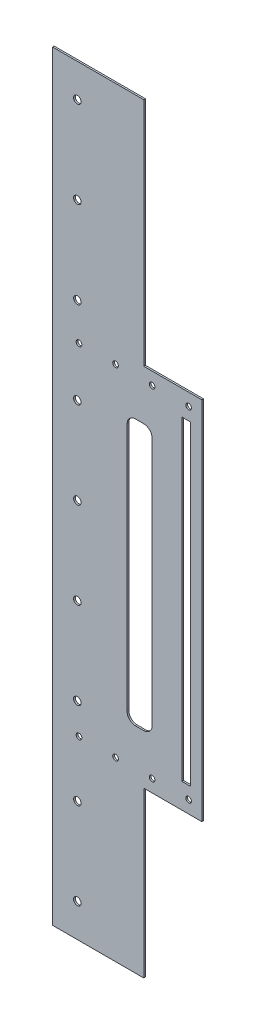
from build123d import *

# Parameters (mm, degrees)
EXTRUDE_1_DEPTH       = 1
HOLE_WIZARD_M41_D     = 4.5
HOLE_WIZARD_M41_DEPTH = 5
HOLE_WIZARD_M41_TIP   = 1.351936393
SKETCH_4_W            = 5
SKETCH_4_H            = 190
SKETCH_4_W_2          = 15
SKETCH_4_H_2          = 160
CUT_EXTRUDE_1_DEPTH   = 467.760109692
FILLET_1_R            = 5
HOLE_WIZARD_M31_D     = 3.4
HOLE_WIZARD_M31_DEPTH = 5
HOLE_WIZARD_M31_TIP   = 1.021463052


with BuildPart() as part:
    # Эскиз1 → Бобышка-Вытянуть1 (new body)
    with BuildSketch(Plane.XY):
        Polygon((55, 319), (55, 458), (0, 458), (0, 0), (55, 0), (55, 99), (90, 99), (90, 319), align=None)
    extrude(amount=EXTRUDE_1_DEPTH)

    # Отверстие с зазором M41
    with Locations(Plane.XY.offset(1)):
        with Locations((15, 20), (15, 72.25), (15, 124.5), (15, 176.75), (15, 229), (15, 281.25), (15, 333.5), (15, 385.75), (15, 438)):
            Hole(HOLE_WIZARD_M41_D / 2, depth=HOLE_WIZARD_M41_DEPTH)
            with Locations((0, 0, -(HOLE_WIZARD_M41_DEPTH + HOLE_WIZARD_M41_TIP / 2))):  # 118° drill point
                Cone(0, HOLE_WIZARD_M41_D / 2, HOLE_WIZARD_M41_TIP, mode=Mode.SUBTRACT)

    # Эскиз4 → Вырез-Вытянуть1 (cut, through all)
    with BuildSketch(Plane.XY.offset(1)):
        with Locations((80.5, 209)):
            Rectangle(SKETCH_4_W, SKETCH_4_H)
        with Locations((52.5, 209)):
            Rectangle(SKETCH_4_W_2, SKETCH_4_H_2)
    extrude(amount=-CUT_EXTRUDE_1_DEPTH, mode=Mode.SUBTRACT)

    # Скругление1
    fillet_1_edges = [part.edges().sort_by_distance(p)[0] for p in [
        (60, 289, 0.5),
        (60, 129, 0.5),
        (45, 129, 0.5),
        (45, 289, 0.5),
    ]]
    fillet(fillet_1_edges, radius=FILLET_1_R)

    # Отверстие с зазором M31
    with Locations(Plane.XY.offset(1)):
        with Locations((82, 106.5), (82, 311.5), (60, 106.5), (60, 311.5), (38, 106.5), (38, 311.5), (16, 106.5), (16, 311.5)):
            Hole(HOLE_WIZARD_M31_D / 2, depth=HOLE_WIZARD_M31_DEPTH)
            with Locations((0, 0, -(HOLE_WIZARD_M31_DEPTH + HOLE_WIZARD_M31_TIP / 2))):  # 118° drill point
                Cone(0, HOLE_WIZARD_M31_D / 2, HOLE_WIZARD_M31_TIP, mode=Mode.SUBTRACT)


solid = part.part
